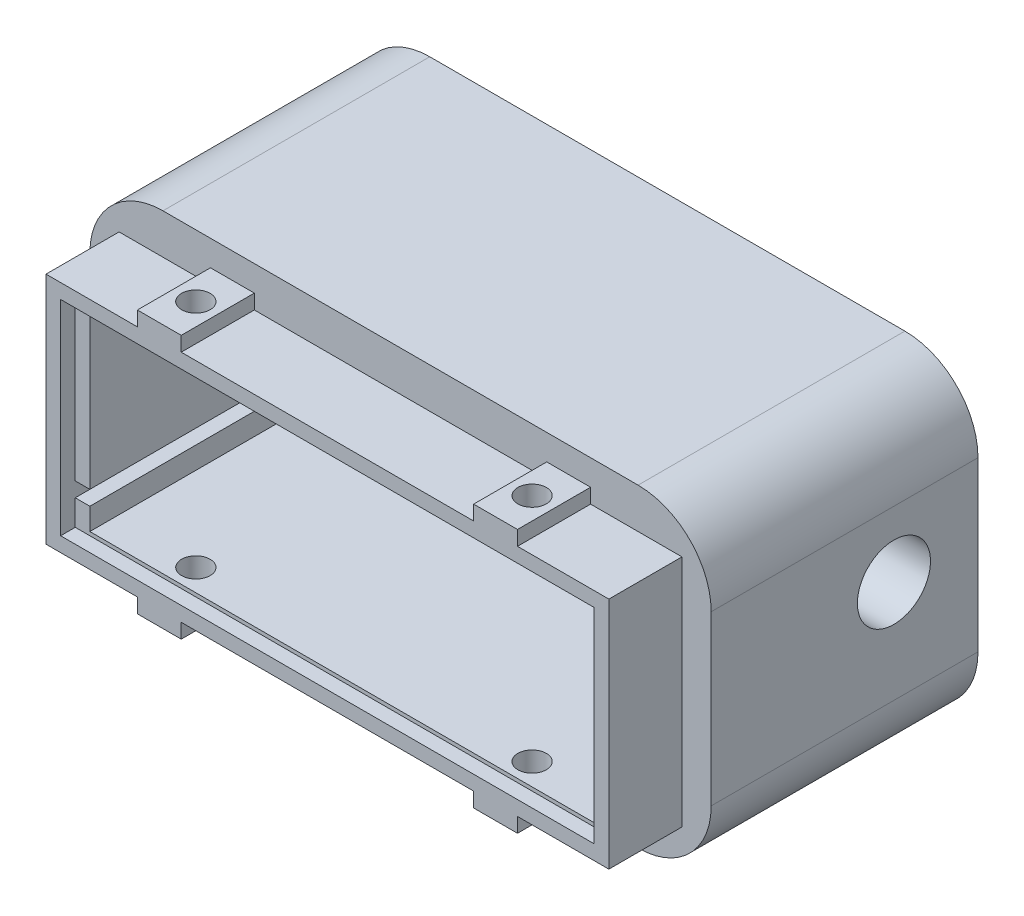
from build123d import *

# Parameters (mm, degrees)
P_IDAT_VYSUNUT_M1_DEPTH                           = 46.5
P_IDAT_VYSUNUT_M2_DEPTH                           = 6.5
V_LCOV_ZAHLOUBEN_PRO_M6_ROUBY_S_V_LCO_D           = 6.6
V_LCOV_ZAHLOUBEN_PRO_M6_ROUBY_S_V_LCO_CBORE_D     = 13
V_LCOV_ZAHLOUBEN_PRO_M6_ROUBY_S_V_LCO_CBORE_DEPTH = 4.6
SKICA6_R                                          = 5
ODEBRAT_VYSUNUT_M1_DEPTH                          = 93.485133941
SKICA7_W                                          = 73
SKICA7_H                                          = 28
ODEBRAT_VYSUNUT_M2_DEPTH                          = 2
ODEBRAT_START                                     = -10
SKICA8_W                                          = 97
SKICA8_H                                          = 52
SKICA8_W_2                                        = 77
SKICA8_H_2                                        = 32
ODEBRAT_VYSUNUT_M5_DEPTH                          = 10
SKICA9_W                                          = 6
SKICA9_H                                          = 5
P_IDAT_VYSUNUT_M3_DEPTH                           = 2
D_RY_PRO_KOL_K_VELIKOST_MM1_REACH                 = 76.356
D_RY_PRO_KOL_K_VELIKOST_MM1_BORE_R                = 1.95


with BuildPart() as part:
    # Skica1 → Přidat vysunutím1 (new body)
    with BuildSketch(Plane.XY):
        with BuildLine():
            Line((-32.5, -21.5), (0, -21.5))
            Line((0, -21.5), (32.5, -21.5))
            ThreePointArc((32.5, -21.5), (39.571067812, -18.571067812), (42.5, -11.5))
            Line((42.5, -11.5), (42.5, 11.5))
            ThreePointArc((42.5, 11.5), (39.571067812, 18.571067812), (32.5, 21.5))
            Line((32.5, 21.5), (-32.5, 21.5))
            ThreePointArc((-32.5, 21.5), (-39.571067812, 18.571067812), (-42.5, 11.5))
            Line((-42.5, 11.5), (-42.5, -11.5))
            ThreePointArc((-42.5, -11.5), (-39.571067812, -18.571067812), (-32.5, -21.5))
        make_face()
        Polygon((-34.5, -8.5), (-34.5, 13.5), (34.5, 13.5), (34.5, -8.5), (36.5, -8.5), (36.5, -10.5), (34.5, -10.5), (34.5, -13.5), (0, -13.5), (-34.5, -13.5), (-34.5, -10.5), (-36.5, -10.5), (-36.5, -8.5), align=None, mode=Mode.SUBTRACT)
    extrude(amount=P_IDAT_VYSUNUT_M1_DEPTH)

    # Skica2 → Přidat vysunutím2 (add)
    with BuildSketch(Plane(origin=(0, 0, 0), x_dir=(-1, 0, 0), z_dir=(0, 0, -1))):
        Polygon((34.5, 11.5), (-34.5, 11.5), (-34.5, -8.5), (-36.5, -8.5), (-36.5, -10.5), (-34.5, -10.5), (-34.5, -11.5), (34.5, -11.5), (34.5, -10.5), (36.5, -10.5), (36.5, -8.5), (34.5, -8.5), align=None)
        Polygon((-10, 7.5), (10, 7.5), (10, -7.5), (-10, -7.5), (-10, 0), align=None, mode=Mode.SUBTRACT)
    extrude(amount=-P_IDAT_VYSUNUT_M2_DEPTH)

    # Válcové zahloubení pro M6 šrouby s válcovou hlavou zaoblenou1 (through all)
    with Locations(Plane.XY.offset(6.5)):
        with Locations((-19, 0), (19, 0)):
            CounterBoreHole(V_LCOV_ZAHLOUBEN_PRO_M6_ROUBY_S_V_LCO_D / 2, V_LCOV_ZAHLOUBEN_PRO_M6_ROUBY_S_V_LCO_CBORE_D / 2, V_LCOV_ZAHLOUBEN_PRO_M6_ROUBY_S_V_LCO_CBORE_DEPTH)

    # Skica6 → Odebrat vysunutím1 (cut, through all)
    with BuildSketch(Plane.ZY.offset(-34.5)):
        with Locations((11.5, 2.5)):
            Circle(SKICA6_R)
    extrude(amount=-ODEBRAT_VYSUNUT_M1_DEPTH, mode=Mode.SUBTRACT)

    # Skica7 → Odebrat vysunutím2 (cut)
    with BuildSketch(Plane.XY.offset(46.5)):
        Rectangle(SKICA7_W, SKICA7_H)
    extrude(amount=-ODEBRAT_VYSUNUT_M2_DEPTH, mode=Mode.SUBTRACT)

    # Skica8 → Odebrat vysunutím5 (cut)
    # profile 1 of 2: a face of its own
    with BuildSketch(Plane.XY.offset(46.5).offset(ODEBRAT_START)):
        Rectangle(SKICA8_W, SKICA8_H)
        with BuildLine():
            Line((-32.5, -21.5), (32.5, -21.5))
            ThreePointArc((32.5, -21.5), (39.571067812, -18.571067812), (42.5, -11.5))
            Line((42.5, -11.5), (42.5, 11.5))
            ThreePointArc((42.5, 11.5), (39.571067812, 18.571067812), (32.5, 21.5))
            Line((32.5, 21.5), (-32.5, 21.5))
            ThreePointArc((-32.5, 21.5), (-39.571067812, 18.571067812), (-42.5, 11.5))
            Line((-42.5, 11.5), (-42.5, -11.5))
            ThreePointArc((-42.5, -11.5), (-39.571067812, -18.571067812), (-32.5, -21.5))
        make_face(mode=Mode.SUBTRACT)
    # profile 2 of 2: a face of its own
    with BuildSketch(Plane.XY.offset(46.5).offset(ODEBRAT_START)):
        with BuildLine():
            ThreePointArc((-42.5, -11.5), (-39.571067812, -18.571067812), (-32.5, -21.5))
            Line((-32.5, -21.5), (32.5, -21.5))
            ThreePointArc((32.5, -21.5), (39.571067812, -18.571067812), (42.5, -11.5))
            Line((42.5, -11.5), (42.5, 11.5))
            ThreePointArc((42.5, 11.5), (39.571067812, 18.571067812), (32.5, 21.5))
            Line((32.5, 21.5), (-32.5, 21.5))
            ThreePointArc((-32.5, 21.5), (-39.571067812, 18.571067812), (-42.5, 11.5))
            Line((-42.5, 11.5), (-42.5, -11.5))
        make_face()
        Rectangle(SKICA8_W_2, SKICA8_H_2, mode=Mode.SUBTRACT)
    extrude(amount=ODEBRAT_VYSUNUT_M5_DEPTH, mode=Mode.SUBTRACT)

    # Skica9 → Přidat vysunutím3 (add)
    with BuildSketch(Plane(origin=(0, 16, 0), x_dir=(1, 0, 0), z_dir=(0, 1, 0))):
        with Locations((-23, -44)):
            Rectangle(SKICA9_W, SKICA9_H)
        with Locations((-23, -39)):
            Rectangle(SKICA9_W, SKICA9_H)
        with Locations((23, -44)):
            Rectangle(SKICA9_W, SKICA9_H)
        with Locations((23, -39)):
            Rectangle(SKICA9_W, SKICA9_H)
    p_idat_vysunut_m3 = extrude(amount=P_IDAT_VYSUNUT_M3_DEPTH)

    # Zrcadlit1: Přidat vysunutím3 across plane
    add(p_idat_vysunut_m3.mirror(Plane(origin=(0, 0, 0), x_dir=(0, 0, 1), z_dir=(0, -1, 0))))

    # Díry pro kolík, velikost mm1 bore → Díry pro kolík, velikost mm1 (cut, up to next)
    with BuildSketch(Plane(origin=(0, -18, 0), x_dir=(-1, 0, 0), z_dir=(0, -1, 0)), mode=Mode.PRIVATE) as d_ry_pro_kol_k_velikost_mm1_sk1:
        with Locations((-23, -41.5)):
            Circle(D_RY_PRO_KOL_K_VELIKOST_MM1_BORE_R)
    d_ry_pro_kol_k_velikost_mm1_tool1 = extrude(d_ry_pro_kol_k_velikost_mm1_sk1.sketch, amount=-D_RY_PRO_KOL_K_VELIKOST_MM1_REACH, mode=Mode.PRIVATE) & part.part
    # Díry pro kolík, velikost mm1 bore → Díry pro kolík, velikost mm1 (cut, up to next)
    with BuildSketch(Plane(origin=(0, -18, 0), x_dir=(-1, 0, 0), z_dir=(0, -1, 0)), mode=Mode.PRIVATE) as d_ry_pro_kol_k_velikost_mm1_sk2:
        with Locations((23, -41.5)):
            Circle(D_RY_PRO_KOL_K_VELIKOST_MM1_BORE_R)
    d_ry_pro_kol_k_velikost_mm1_tool2 = extrude(d_ry_pro_kol_k_velikost_mm1_sk2.sketch, amount=-D_RY_PRO_KOL_K_VELIKOST_MM1_REACH, mode=Mode.PRIVATE) & part.part
    d_ry_pro_kol_k_velikost_mm1_1 = d_ry_pro_kol_k_velikost_mm1_tool1.solids().sort_by_distance((23, -18, 41.5))[0]
    add(d_ry_pro_kol_k_velikost_mm1_1, mode=Mode.SUBTRACT)
    d_ry_pro_kol_k_velikost_mm1_2 = d_ry_pro_kol_k_velikost_mm1_tool2.solids().sort_by_distance((-23, -18, 41.5))[0]
    add(d_ry_pro_kol_k_velikost_mm1_2, mode=Mode.SUBTRACT)
    d_ry_pro_kol_k_velikost_mm1 = d_ry_pro_kol_k_velikost_mm1_1 + d_ry_pro_kol_k_velikost_mm1_2  # Díry pro kolík, velikost mm1 as one shape, for the pattern or mirror that repeats it

    # Zrcadlit2: Díry pro kolík, velikost mm1 across plane
    add(d_ry_pro_kol_k_velikost_mm1.mirror(Plane(origin=(0, 0, 0), x_dir=(0, 0, 1), z_dir=(0, -1, 0))), mode=Mode.SUBTRACT)


solid = part.part
